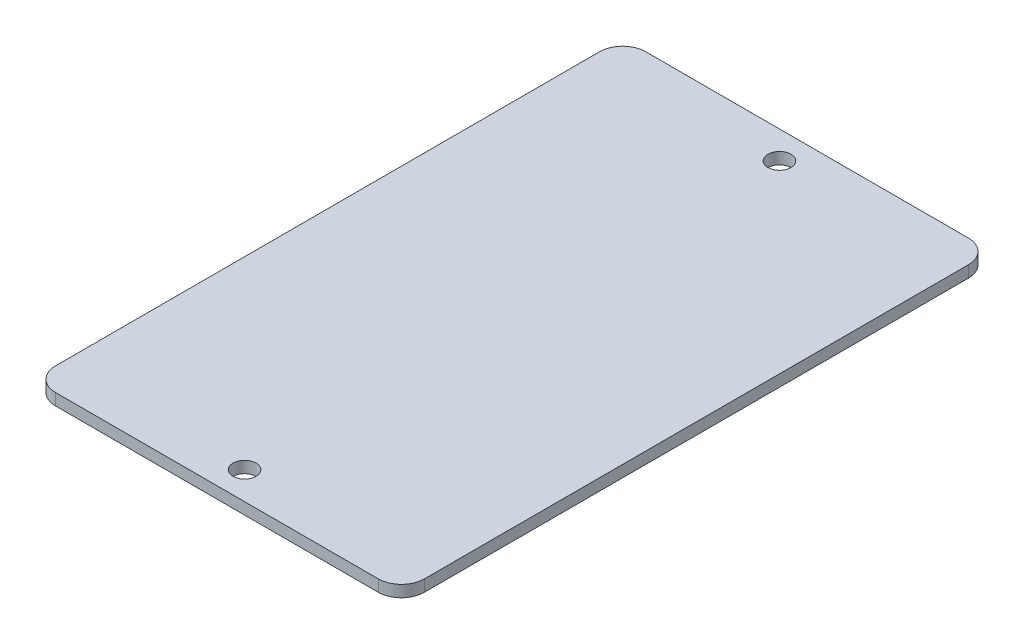
from build123d import *

# Parameters (mm, degrees)
SKETCH1_W           = 50.8
SKETCH1_H           = 81.28
BOSS_EXTRUDE1_DEPTH = 0.8001
SKETCH2_R           = 1.5875
CUT_EXTRUDE1_DEPTH  = 48.951331994
FILLET1_R           = 3.175


with BuildPart() as part:
    # Sketch1 → Boss-Extrude1 (new, symmetric)
    with BuildSketch(Plane(origin=(0, 0, 0), x_dir=(1, 0, 0), z_dir=(0, 1, 0))):
        Rectangle(SKETCH1_W, SKETCH1_H)
    extrude(amount=BOSS_EXTRUDE1_DEPTH, both=True)

    # Sketch2 → Cut-Extrude1 (cut, through all)
    with BuildSketch(Plane(origin=(0, 0.8001, 0), x_dir=(1, 0, 0), z_dir=(0, 1, 0))):
        with Locations(Location((0, 36.83, 0), (0, 0, 270))):
            Circle(SKETCH2_R)
        with Locations(Location((0, -36.83, 0), (0, 0, 270))):
            Circle(SKETCH2_R)
    extrude(amount=-CUT_EXTRUDE1_DEPTH, mode=Mode.SUBTRACT)

    # Fillet1
    fillet1_edges = [part.edges().sort_by_distance(p)[0] for p in [
        (25.4, 0, 40.64),
        (-25.4, 0, 40.64),
        (-25.4, 0, -40.64),
        (25.4, 0, -40.64),
    ]]
    fillet(fillet1_edges, radius=FILLET1_R)


solid = part.part
